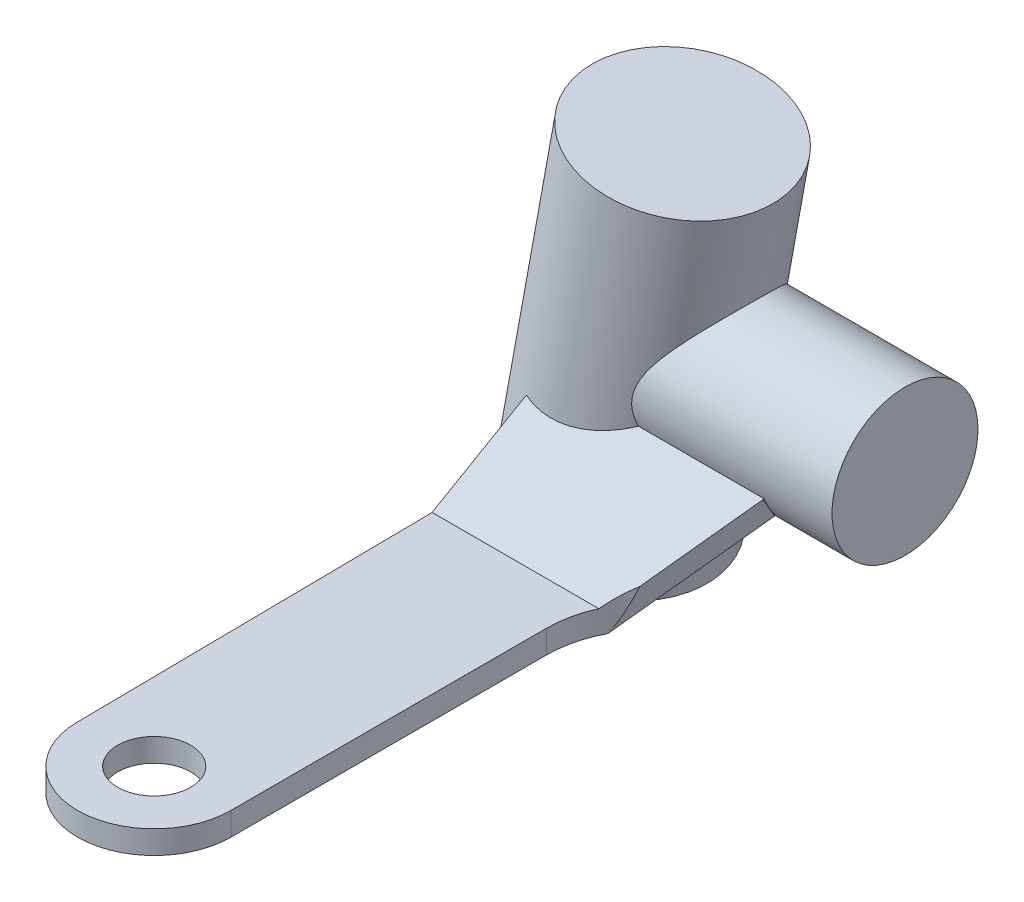
from build123d import *

# Parameters (mm, degrees)
BOSS_EXTRUDE1_DEPTH      = 25
BOSS_EXTRUDE1_DEPTH_BACK = 10
SKETCH1_R                = 10
SKETCH2_R                = 12.5
BOSS_EXTRUDE2_DEPTH      = 25
BOSS_EXTRUDE3_DEPTH      = 15
BOSS_EXTRUDE3_DEPTH_BACK = 15
CUT_EXTRUDE1_DEPTH       = 10
BOSS_EXTRUDE4_DEPTH      = 3.175
CUT_EXTRUDE2_DEPTH       = 10
SKETCH11_R               = 5
CUT_EXTRUDE6_DEPTH       = 10


with BuildPart() as part:
    # Sketch1 → Boss-Extrude1 (new, two sides: drawn at the far end of the back side and taken through both)
    with BuildSketch(Plane(origin=(0, 0, 0), x_dir=(0, 0, -1), z_dir=(1, 0, 0)).offset(-BOSS_EXTRUDE1_DEPTH_BACK)):
        Circle(SKETCH1_R)
    extrude(amount=BOSS_EXTRUDE1_DEPTH + BOSS_EXTRUDE1_DEPTH_BACK)

    # Sketch2 → Boss-Extrude2 (add, symmetric)
    with BuildSketch(Plane(origin=(-10, 0, 0), x_dir=(0.9848069802426886, -0.173652560203633, 1.5808464272800858e-08), z_dir=(0.17364817766692736, 0.9847821256419462, -0.007104604780387524))):
        Circle(SKETCH2_R)
    extrude(amount=BOSS_EXTRUDE2_DEPTH, both=True)

    # Sketch5 → Boss-Extrude3 (add, two sides: drawn at the far end of the back side and taken through both)
    with BuildSketch(Plane(origin=(0, 0, 0), x_dir=(0, 0, -1), z_dir=(1, 0, 0)).offset(-BOSS_EXTRUDE3_DEPTH_BACK)):
        Polygon((0.79375, -1.374815329), (-0.79375, 1.374815329), (-25.529710951, -12.906498385), (-23.942210951, -15.656129042), align=None)
    extrude(amount=BOSS_EXTRUDE3_DEPTH + BOSS_EXTRUDE3_DEPTH_BACK)

    # Sketch6 → Cut-Extrude1 (cut)
    with BuildSketch(Plane(origin=(0, -1.374815329, -0.79375), x_dir=(1, 0, 0), z_dir=(0, -0.8660254037844415, -0.4999999999999954))):
        Polygon((15, 28.562627427), (15, 10), (8.243756147, 28.562627427), align=None)
    extrude(amount=-CUT_EXTRUDE1_DEPTH, mode=Mode.SUBTRACT)

    # Sketch7 → Boss-Extrude4 (add)
    with BuildSketch(Plane.XZ.offset(15.656129042)):
        with BuildLine():
            Line((-14.420950658, 73.942210951), (-15, 23.942210951))
            Line((-15, 23.942210951), (8.243756147, 23.942210951))
            ThreePointArc((8.243756147, 23.942210951), (7.001386396, 27.211000098), (6.579049342, 30.68232499))
            Line((6.579049342, 30.68232499), (6.579049342, 73.942210951))
            ThreePointArc((6.579049342, 73.942210951), (-3.920950658, 84.442210951), (-14.420950658, 73.942210951))
        make_face()
    extrude(amount=-BOSS_EXTRUDE4_DEPTH)

    # Sketch9 → Cut-Extrude2 (cut)
    with BuildSketch(Plane.XZ.offset(15.656129042)):
        with BuildLine():
            Line((17.296769939, 44.662823633), (24.815608182, 16.701826347))
            ThreePointArc((24.815608182, 16.701826347), (7.075690418, 26.922905868), (17.296769939, 44.662823633))
        make_face()
    extrude(amount=-CUT_EXTRUDE2_DEPTH, mode=Mode.SUBTRACT)

    # Sketch11 → Cut-Extrude6 (cut)
    with BuildSketch(Plane(origin=(0, -12.481129042, 0), x_dir=(1, 0, 0), z_dir=(0, 1, 0))):
        with Locations((-3.920950658, -73.942210951)):
            Circle(SKETCH11_R)
    extrude(amount=-CUT_EXTRUDE6_DEPTH, mode=Mode.SUBTRACT)


solid = part.part
